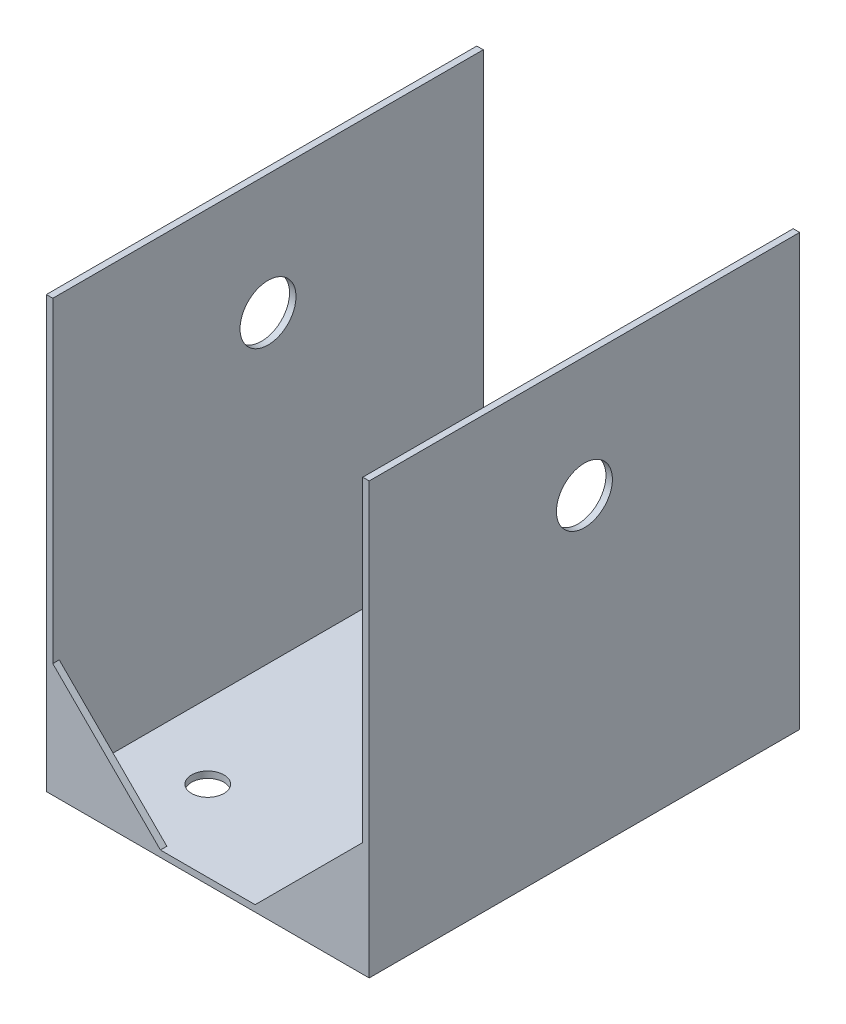
from build123d import *

# Parameters (mm, degrees)
BOSS_EXTRUDE1_DEPTH = 50.8
BOSS_EXTRUDE2_DEPTH = 0.762
BOSS_EXTRUDE3_DEPTH = 0.762
SKETCH4_R           = 3.302
CUT_EXTRUDE1_DEPTH  = 82.319677815
SKETCH5_R           = 1.905
CUT_EXTRUDE2_DEPTH  = 81.845849887


with BuildPart() as part:
    # Sketch1 → Boss-Extrude1 (new body)
    with BuildSketch(Plane.XY):
        Polygon((0, 0), (38.1, 0), (38.1, 50.8), (37.338, 50.8), (37.338, 0.762), (0.762, 0.762), (0.762, 50.8), (0, 50.8), align=None)
    extrude(amount=BOSS_EXTRUDE1_DEPTH)

    # Sketch2 → Boss-Extrude2 (add)
    with BuildSketch(Plane.XY.offset(50.8)):
        Polygon((0.762, 0.762), (13.462, 0.762), (0.762, 13.462), align=None)
        Polygon((37.338, 0.762), (24.638, 0.762), (37.338, 13.462), align=None)
    extrude(amount=-BOSS_EXTRUDE2_DEPTH)

    # Sketch3 → Boss-Extrude3 (add)
    with BuildSketch(Plane(origin=(0, 0, 0), x_dir=(-1, 0, 0), z_dir=(0, 0, -1))):
        Polygon((-37.338, 13.462), (-37.338, 0.762), (-24.638, 0.762), align=None)
        Polygon((-0.762, 0.762), (-13.462, 0.762), (-0.762, 13.462), align=None)
    extrude(amount=-BOSS_EXTRUDE3_DEPTH)

    # Sketch4 → Cut-Extrude1 (cut, through all)
    with BuildSketch(Plane.ZY):
        with Locations((25.4, 36.624302666)):
            Circle(SKETCH4_R)
    extrude(amount=-CUT_EXTRUDE1_DEPTH, mode=Mode.SUBTRACT)

    # Sketch5 → Cut-Extrude2 (cut, through all)
    with BuildSketch(Plane(origin=(0, 0.762, 0), x_dir=(1, 0, 0), z_dir=(0, 1, 0))):
        with Locations(Location((9.525, -9.525, 0), (0, 0, 270))):
            Circle(SKETCH5_R)
        with Locations(Location((9.525, -41.275, 0), (0, 0, 270))):
            Circle(SKETCH5_R)
        with Locations(Location((28.575, -41.275, 0), (0, 0, 270))):
            Circle(SKETCH5_R)
        with Locations(Location((28.575, -9.525, 0), (0, 0, 270))):
            Circle(SKETCH5_R)
    extrude(amount=-CUT_EXTRUDE2_DEPTH, mode=Mode.SUBTRACT)


solid = part.part
